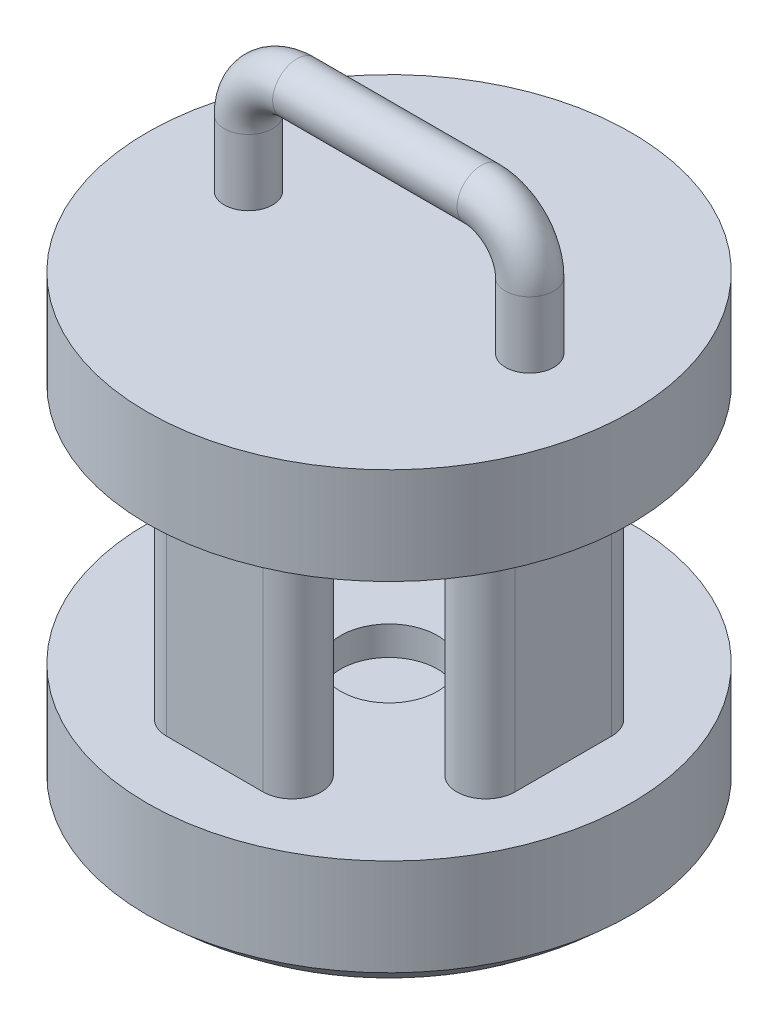
from build123d import *

# Parameters (mm, degrees)
SKETCH1_R               = 6.35
BUTTON_DEPTH            = 2.54
ONE_LEG_DEPTH           = 6.35
MOAR_LEGS_COUNT         = 4
SKETCH3_R               = 6.35
BUTTON_BOTTOM_DEPTH     = 2.54
BUTTON_TOP_FACE_RADIUS  = 6.35
BUTTON_TOP_HEIGHT       = 2.54
SKETCH5_R               = 0.635
SKETCH6_R               = 1.27
RECESS_FOR_SPRING_DEPTH = 0.762


with BuildPart() as part:
    # Sketch1 → button (new body)
    with BuildSketch(Plane(origin=(0, 0, 0), x_dir=(1, 0, 0), z_dir=(0, 1, 0))):
        with Locations(Location((0, 0, 0), (0, 0, 270))):
            Circle(SKETCH1_R)
    extrude(amount=BUTTON_DEPTH)

    # Sketch2 → one leg (add)
    with BuildSketch(Plane(origin=(0, 2.54, 0), x_dir=(1, 0, 0), z_dir=(0, 1, 0))):
        with BuildLine():
            Line((-1.27, -3.048), (1.27, -3.048))
            ThreePointArc((1.27, -3.048), (2.032, -3.81), (1.27, -4.572))
            Line((1.27, -4.572), (-1.27, -4.572))
            ThreePointArc((-1.27, -4.572), (-2.032, -3.81), (-1.27, -3.048))
        make_face()
    one_leg = extrude(amount=ONE_LEG_DEPTH)

    # moar legs: one leg ×4 about axis
    moar_legs_axis = Axis((0, 0, 0), (0, 1, 0))
    for i in range(1, MOAR_LEGS_COUNT):
        add(one_leg.rotate(moar_legs_axis, i * 360 / MOAR_LEGS_COUNT))

    # Sketch3 → button bottom (add)
    with BuildSketch(Plane(origin=(0, 8.89, 0), x_dir=(1, 0, 0), z_dir=(0, 1, 0))):
        with Locations(Location((0, 0, 0), (0, 0, 270))):
            Circle(SKETCH3_R)
    extrude(amount=BUTTON_BOTTOM_DEPTH)

    # button top: a dome of height H over a round flat face of radius A is a cap of a sphere of radius (A * A + H * H) / (2 * H)
    button_top_r = (BUTTON_TOP_FACE_RADIUS * BUTTON_TOP_FACE_RADIUS + BUTTON_TOP_HEIGHT * BUTTON_TOP_HEIGHT) / (2 * BUTTON_TOP_HEIGHT)
    button_top_base = Plane((0, 0, 0), z_dir=(0, -1, 0))
    with Locations(button_top_base.offset(BUTTON_TOP_HEIGHT - button_top_r)):
        button_top_ball = Sphere(button_top_r, mode=Mode.PRIVATE)
    add(split(button_top_ball, bisect_by=button_top_base, keep=Keep.TOP, mode=Mode.PRIVATE))

    # handle for linkage: sweep along a path in Sketch4
    with BuildLine(Plane.XY) as handle_for_linkage_path:
        Line((-3.689676867, 11.43), (-3.689676867, 13.163817949))
        ThreePointArc((-3.689676867, 13.163817949), (-3.317702479, 14.061843561), (-2.419676867, 14.433817949))
        Line((-2.419676867, 14.433817949), (2.419676867, 14.433817949))
        ThreePointArc((2.419676867, 14.433817949), (3.317702479, 14.061843561), (3.689676867, 13.163817949))
        Line((3.689676867, 13.163817949), (3.689676867, 11.43))
    # Sketch5 → handle for linkage (sweep)
    with BuildSketch(Plane(origin=(0, 11.43, 0), x_dir=(1, 0, 0), z_dir=(0, 1, 0))):
        with Locations((-3.689676867, 0)):
            Circle(SKETCH5_R)
    sweep(path=handle_for_linkage_path.line)

    # Sketch6 → recess for spring (cut)
    with BuildSketch(Plane(origin=(0, 2.54, 0), x_dir=(1, 0, 0), z_dir=(0, 1, 0))):
        with Locations(Location((0, 0, 0), (0, 0, 270))):
            Circle(SKETCH6_R)
    extrude(amount=-RECESS_FOR_SPRING_DEPTH, mode=Mode.SUBTRACT)


solid = part.part
